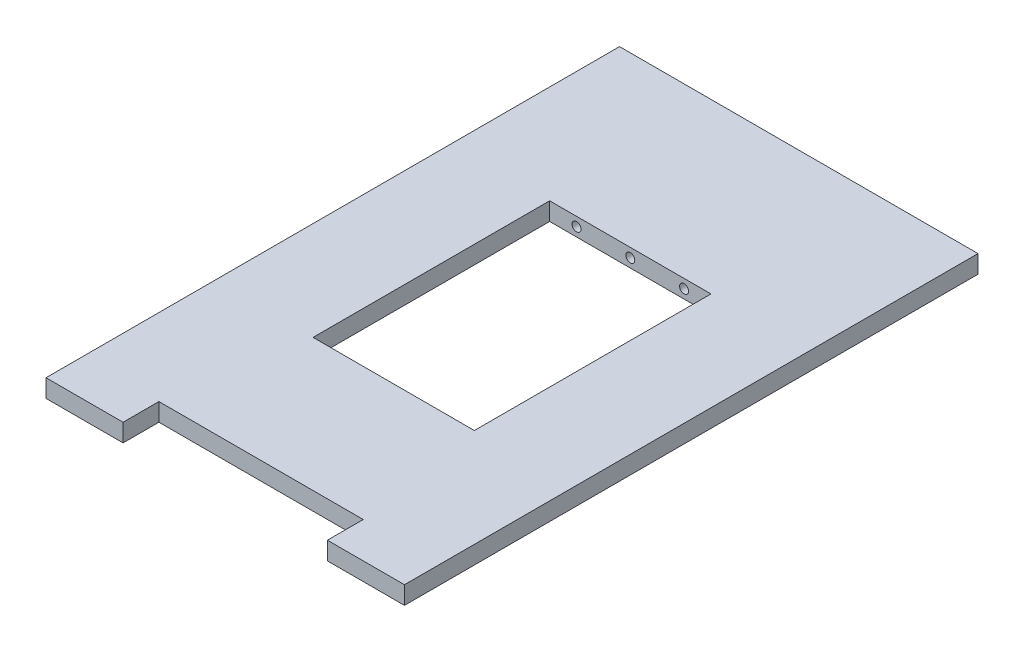
from build123d import *

# Parameters (mm, degrees)
SKETCH1_W                 = 100
SKETCH1_H                 = 160
BOSS_EXTRUDE1_DEPTH       = 5
SKETCH2_W                 = 45
SKETCH2_H                 = 66
CUT_EXTRUDE1_DEPTH        = 95.472218138
F_2_5MM_DOWEL_HOLE1_D     = 2.5
F_2_5MM_DOWEL_HOLE1_DEPTH = 10
F_2_5MM_DOWEL_HOLE1_TIP   = 0.751075774
F_2_5MM_DOWEL_HOLE2_D     = 2.5
F_2_5MM_DOWEL_HOLE2_DEPTH = 10
F_2_5MM_DOWEL_HOLE2_TIP   = 0.751075774
SKETCH8_W                 = 57
SKETCH8_H                 = 20
CUT_EXTRUDE2_DEPTH        = 95.472218138


with BuildPart() as part:
    # Sketch1 → Boss-Extrude1 (new body)
    with BuildSketch(Plane(origin=(0, 0, 0), x_dir=(1, 0, 0), z_dir=(0, 1, 0))):
        Rectangle(SKETCH1_W, SKETCH1_H)
    extrude(amount=BOSS_EXTRUDE1_DEPTH)

    # Sketch2 → Cut-Extrude1 (cut, through all)
    with BuildSketch(Plane(origin=(0, 5, 0), x_dir=(1, 0, 0), z_dir=(0, 1, 0))):
        Rectangle(SKETCH2_W, SKETCH2_H)
    extrude(amount=-CUT_EXTRUDE1_DEPTH, mode=Mode.SUBTRACT)

    # Ø2.5mm Dowel Hole1
    with Locations(Plane.XY.offset(-33)):
        with Locations((0, 2.5), (15, 2.5), (-15, 2.5)):
            Hole(F_2_5MM_DOWEL_HOLE1_D / 2, depth=F_2_5MM_DOWEL_HOLE1_DEPTH)
            with Locations((0, 0, -(F_2_5MM_DOWEL_HOLE1_DEPTH + F_2_5MM_DOWEL_HOLE1_TIP / 2))):  # 118° drill point
                Cone(0, F_2_5MM_DOWEL_HOLE1_D / 2, F_2_5MM_DOWEL_HOLE1_TIP, mode=Mode.SUBTRACT)

    # Ø2.5mm Dowel Hole2
    with Locations(Plane(origin=(0, 0, 33), x_dir=(-1, 0, 0), z_dir=(0, 0, -1))):
        with Locations((0, 2.5), (15, 2.5), (-15, 2.5)):
            Hole(F_2_5MM_DOWEL_HOLE2_D / 2, depth=F_2_5MM_DOWEL_HOLE2_DEPTH)
            with Locations((0, 0, -(F_2_5MM_DOWEL_HOLE2_DEPTH + F_2_5MM_DOWEL_HOLE2_TIP / 2))):  # 118° drill point
                Cone(0, F_2_5MM_DOWEL_HOLE2_D / 2, F_2_5MM_DOWEL_HOLE2_TIP, mode=Mode.SUBTRACT)

    # Sketch8 → Cut-Extrude2 (cut, through all)
    with BuildSketch(Plane(origin=(0, 5, 0), x_dir=(1, 0, 0), z_dir=(0, 1, 0))):
        with Locations((0, -80)):
            Rectangle(SKETCH8_W, SKETCH8_H)
    extrude(amount=-CUT_EXTRUDE2_DEPTH, mode=Mode.SUBTRACT)


solid = part.part
